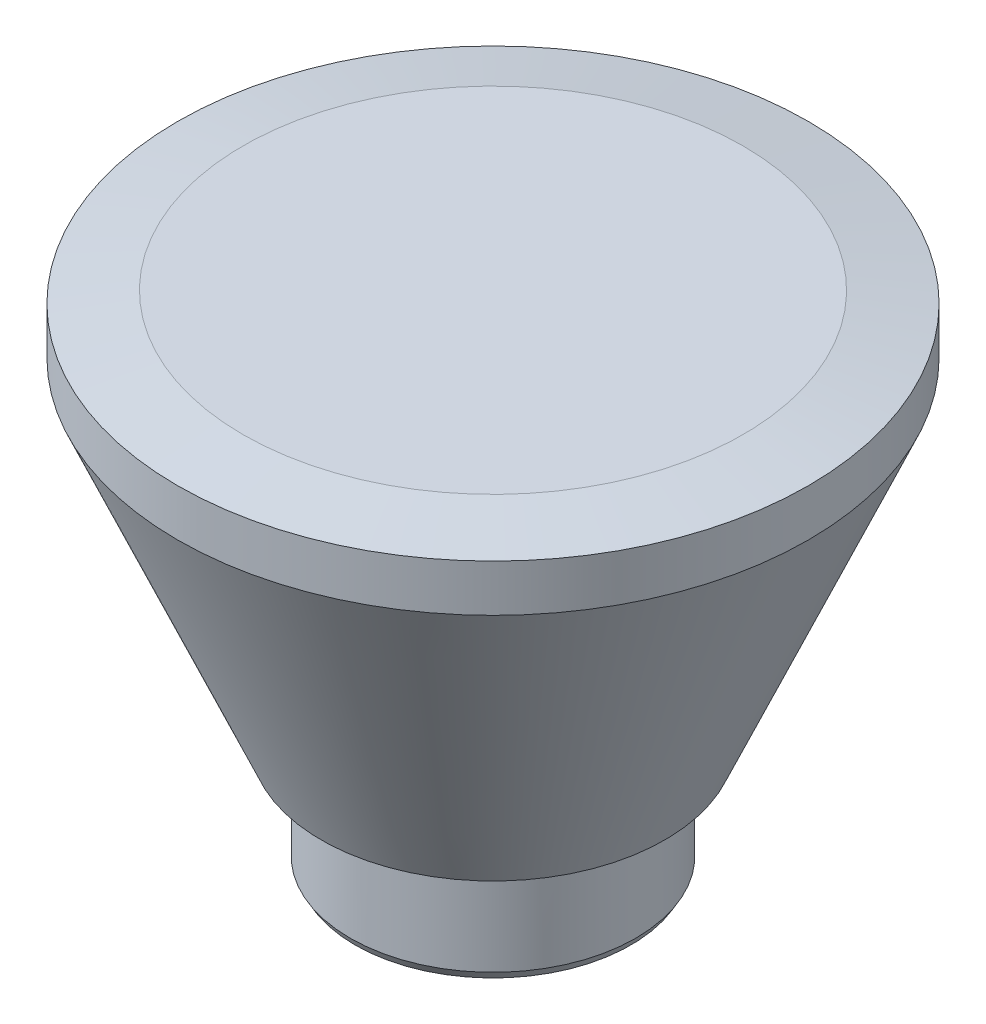
from build123d import *

# Parameters (mm, degrees)
CUT_EXTRUDE1_REACH             = 38.532
CUT_EXTRUDE1_DIRECTION_2_REACH = 38.532
CHAMFER1_SIZE                  = 1
CHAMFER2_SIZE                  = 0.5
CHAMFER2_SIZE2                 = 0.288675135


with BuildPart() as part:
    # Sketch1 → Revolve1 (revolve)
    with BuildSketch(Plane.XY, mode=Mode.PRIVATE) as revolve1_sk:
        Polygon((-15.060768988, 23.176328976), (-19, 22.481736265), (-19, 19.651328976), (-10.35, -0.323671024), (-8.6, -0.323671024), (-8.6, -6.823671024), (-5.6, -6.823671024), (-5.6, 3.426328976), (-3, 3.426328976), (-3, -1.573671024), (0, -1.573671024), (0, 23.176328976), align=None)
    revolve(revolve1_sk.sketch.rotate(Axis((0, -1.573671024, 0), (0, 1, 0)), 270), axis=Axis((0, -1.573671024, 0), (0, 1, 0)))

    # Cut-Extrude1: up to this face of the body (flat: up to its plane)
    cut_extrude1_end = Plane(part.part.faces().sort_by_distance((0, 3.426328976, 5.441608081))[0])
    # Sketch3 → Cut-Extrude1 (cut, up to the picked face)
    with BuildSketch(Plane.XZ.offset(1.573671024), mode=Mode.PRIVATE) as cut_extrude1_sk1:
        Polygon((0.75, 1.85), (0, 1.1), (0, -1.1), (0.75, -1.85), (6.25, -1.85), (7, -1.1), (7, 1.1), (6.25, 1.85), align=None)
    cut_extrude1_tool1 = split(extrude(cut_extrude1_sk1.sketch, amount=-CUT_EXTRUDE1_REACH, mode=Mode.PRIVATE), bisect_by=cut_extrude1_end, keep=Keep.BOTH, mode=Mode.PRIVATE)
    add(cut_extrude1_tool1.solids().sort_by(Axis((3.5, -1.573671, 0), (0, 1, 0)))[0], mode=Mode.SUBTRACT)

    # Cut-Extrude1 direction 2: up to this face of the body (flat: up to its plane)
    cut_extrude1_direction_2_end = Plane(part.part.faces().sort_by_distance((0, -6.823671024, 8.356755267))[0])
    # Sketch3 → Cut-Extrude1 direction 2 (cut, up to the picked face)
    with BuildSketch(Plane.XZ.offset(1.573671024), mode=Mode.PRIVATE) as cut_extrude1_direction_2_sk1:
        Polygon((0.75, 1.85), (0, 1.1), (0, -1.1), (0.75, -1.85), (6.25, -1.85), (7, -1.1), (7, 1.1), (6.25, 1.85), align=None)
    cut_extrude1_direction_2_tool1 = split(extrude(cut_extrude1_direction_2_sk1.sketch, amount=CUT_EXTRUDE1_DIRECTION_2_REACH, mode=Mode.PRIVATE), bisect_by=cut_extrude1_direction_2_end, keep=Keep.BOTH, mode=Mode.PRIVATE)
    add(cut_extrude1_direction_2_tool1.solids().sort_by(Axis((3.5, -1.573671, 0), (0, -1, 0)))[0], mode=Mode.SUBTRACT)

    # Chamfer1
    chamfer1_edges = [part.edges().sort_by_distance(p)[0] for p in [
        (-5.6, -6.823671024, 0),
    ]]
    chamfer(chamfer1_edges, length=CHAMFER1_SIZE)

    # Chamfer2
    chamfer2_edges = [part.edges().sort_by_distance(p)[0] for p in [
        (0, -6.823671024, 8.6),
    ]]
    chamfer2_side = [part.faces().sort_by_distance(p)[0] for p in [
        (0, -3.573671024, 8.6),
    ]]
    chamfer(chamfer2_edges, length=CHAMFER2_SIZE, length2=CHAMFER2_SIZE2, reference=chamfer2_side[0])


solid = part.part
